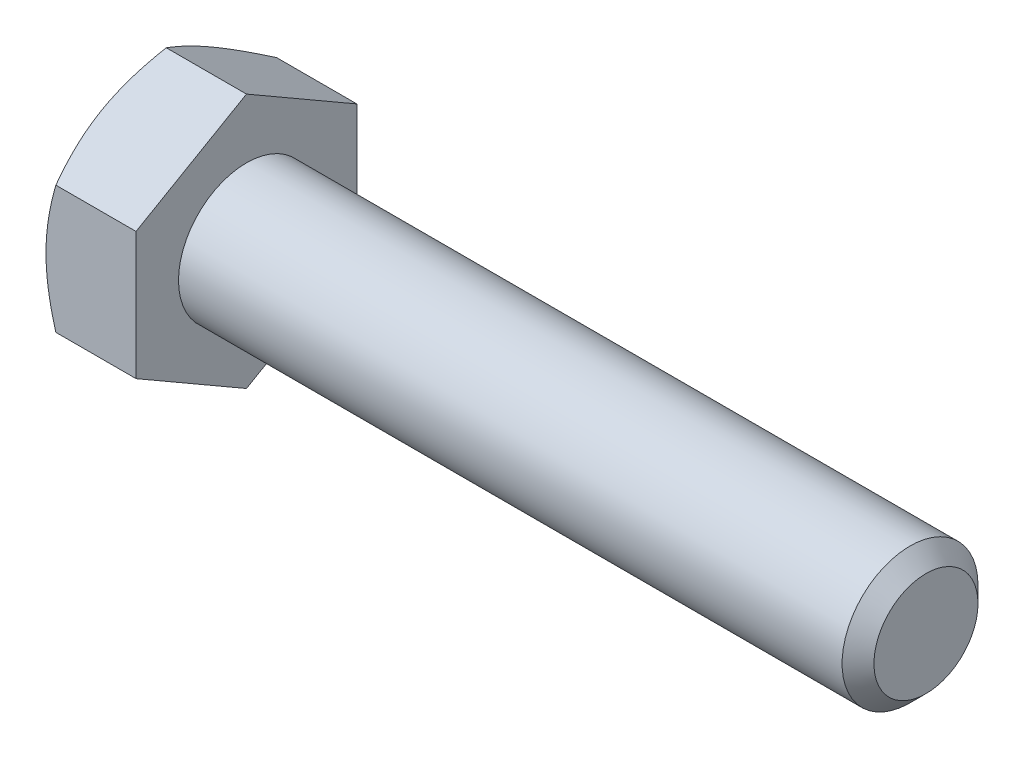
from build123d import *

# Parameters (mm, degrees)
SKETCH2_R           = 4
BOSS_EXTRUDE1_DEPTH = 40
CHAMFER1_SIZE       = 0.9375
BOSS_EXTRUDE2_DEPTH = 5.3
SKETCH6_OUTSIDE_W   = 189.006
SKETCH6_OUTSIDE_H   = 191.018
SKETCH6_OUTSIDE_R   = 6.5
CUT_EXTRUDE1_DEPTH  = 47.375352649
CUT_EXTRUDE1_DRAFT  = -60


with BuildPart() as part:
    # Sketch2 → Boss-Extrude1 (new body)
    with BuildSketch(Plane(origin=(22.65, 0, 0), x_dir=(0, 0, -1), z_dir=(1, 0, 0))):
        Circle(SKETCH2_R)
    extrude(amount=-BOSS_EXTRUDE1_DEPTH)

    # Chamfer1
    chamfer1_edges = [part.edges().sort_by_distance(p)[0] for p in [
        (22.65, 0, 4),
    ]]
    chamfer(chamfer1_edges, length=CHAMFER1_SIZE)

    # Sketch3 → Boss-Extrude2 (add)
    with BuildSketch(Plane.ZY.offset(17.35)):
        Polygon((-6.5, -3.75277675), (0, -7.505553499), (6.5, -3.75277675), (6.5, 3.75277675), (0, 7.505553499), (-6.5, 3.75277675), align=None)
    extrude(amount=BOSS_EXTRUDE2_DEPTH)


with BuildPart() as cut_extrude1_tool:
    # Sketch6 outside → Cut-Extrude1 (with draft: the straight prism first)
    with BuildSketch(Plane.ZY.offset(22.65)):
        Rectangle(SKETCH6_OUTSIDE_W, SKETCH6_OUTSIDE_H)
        Circle(SKETCH6_OUTSIDE_R, mode=Mode.SUBTRACT)
    extrude(amount=-CUT_EXTRUDE1_DEPTH)
    # Cut-Extrude1: the draft: its side faces are tilted about the plane it starts from
    cut_extrude1_sides = [cut_extrude1_tool.faces().sort_by_distance(p)[0] for p in [
        (1.037676325, -95.509, 0),
        (1.037676325, 0, 94.503),
        (1.037676325, 95.509, 0),
        (1.037676325, 0, -94.503),
        (1.037676325, 0, -6.5),
    ]]
    draft(cut_extrude1_sides, Plane.ZY.offset(22.65), CUT_EXTRUDE1_DRAFT)


with BuildPart() as part_1:
    add(part.part)

    # Cut-Extrude1: cut by cut_extrude1_tool
    add(cut_extrude1_tool.part, mode=Mode.SUBTRACT)


solid = part_1.part
